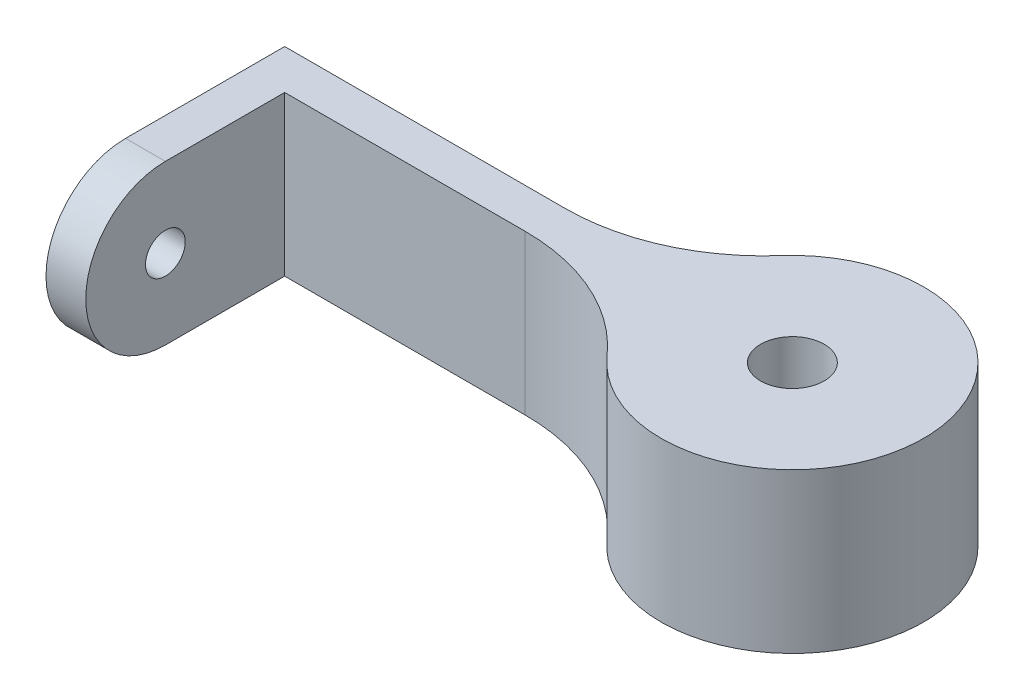
from build123d import *

# Parameters (mm, degrees)
SKETCH1_R           = 1.6
SKETCH1_W           = 2
SKETCH1_H           = 10
BOSS_EXTRUDE1_DEPTH = 8
FILLET1_R           = 10
SKETCH2_R           = 1
CUT_EXTRUDE1_DEPTH  = 2


with BuildPart() as part:
    # Sketch1 → Boss-Extrude1 (new body)
    # profile 1 of 2: a face of its own
    with BuildSketch(Plane(origin=(0, 0, 0), x_dir=(1, 0, 0), z_dir=(0, 1, 0))):
        with BuildLine():
            Line((-6.523802572, 1), (-26.523802572, 1))
            Line((-26.523802572, 1), (-26.523802572, -1))
            Line((-26.523802572, -1), (-24.523802572, -1))
            Line((-24.523802572, -1), (-6.523802572, -1))
            ThreePointArc((-6.523802572, -1), (0, -6.6), (6.523802572, -1))
            ThreePointArc((6.523802572, -1), (6.6, 0), (6.523802572, 1))
            ThreePointArc((6.523802572, 1), (0, 6.6), (-6.523802572, 1))
        make_face()
        with Locations(Location((0, 0, 0), (0, 0, 270))):
            Circle(SKETCH1_R, mode=Mode.SUBTRACT)
    # profile 2 of 2: a face of its own
    with BuildSketch(Plane(origin=(0, 0, 0), x_dir=(1, 0, 0), z_dir=(0, 1, 0))):
        with Locations((-25.523802572, -6)):
            Rectangle(SKETCH1_W, SKETCH1_H)
    extrude(amount=BOSS_EXTRUDE1_DEPTH)

    # Fillet1
    fillet1_edges = [part.edges().sort_by_distance(p)[0] for p in [
        (-6.523802572, 4, 1),
        (-6.523802572, 4, -1),
    ]]
    fillet(fillet1_edges, radius=FILLET1_R)

    # Sketch2 → Cut-Extrude1 (cut)
    with BuildSketch(Plane.ZY.offset(26.523802572)):
        with Locations((7, 4)):
            Circle(SKETCH2_R)
        with BuildLine():
            ThreePointArc((7, 8), (9.828427125, 6.828427125), (11, 4))
            Line((11, 4), (11, 8))
            Line((11, 8), (7, 8))
        make_face()
        with BuildLine():
            ThreePointArc((11, 4), (9.828427125, 1.171572875), (7, 0))
            Line((7, 0), (11, 0))
            Line((11, 0), (11, 4))
        make_face()
    extrude(amount=-CUT_EXTRUDE1_DEPTH, mode=Mode.SUBTRACT)


solid = part.part
